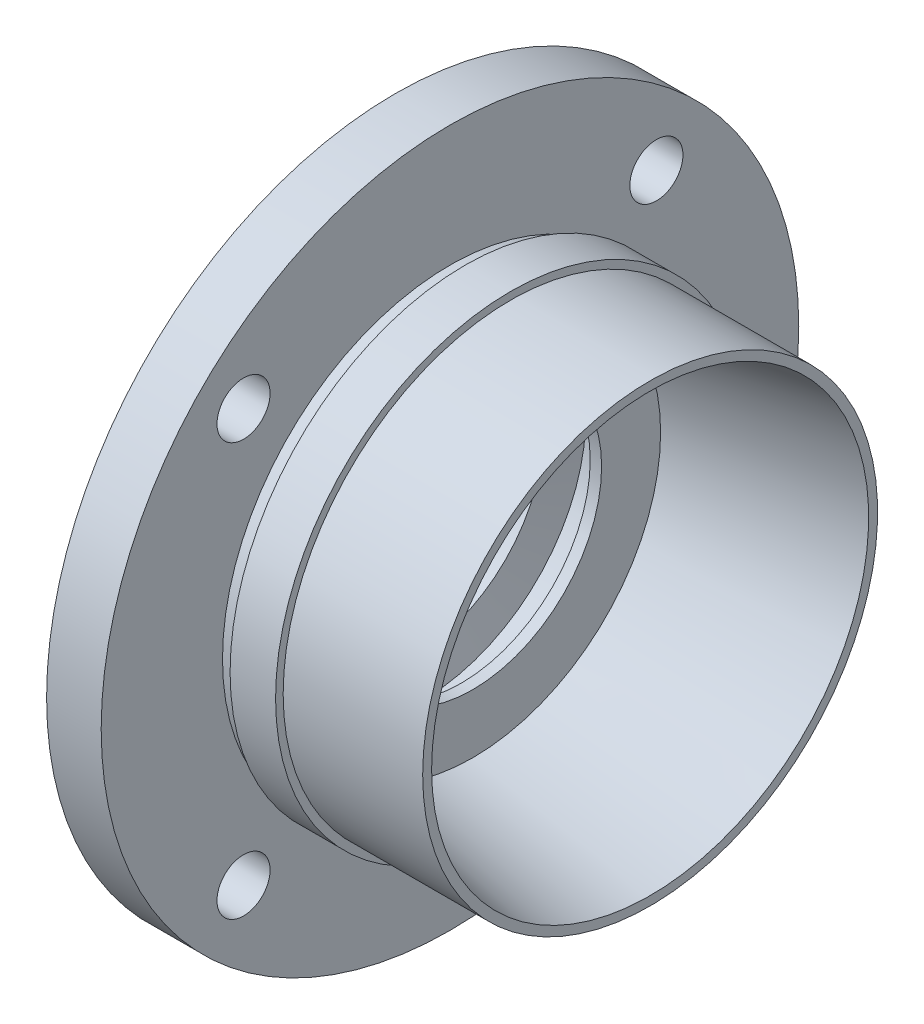
from build123d import *

# Parameters (mm, degrees)
SKETCH_2_R          = 3.5
CUT_EXTRUDE_1_DEPTH = 74.218576878


with BuildPart() as part:
    # 草图1 → 旋转1 (revolve)
    with BuildSketch(Plane.XY, mode=Mode.PRIVATE) as revolve_1_sk:
        Polygon((3.6, 21.5), (2.5, 17), (1, 17), (1, 30), (0, 30), (0, 46), (7.2, 46), (7.2, 30), (9.2, 30), (9.2, 31), (15.2, 31), (15.2, 30), (33.6, 30), (33.6, 28.8226), (10.2, 24.78), (10.2, 17), (8.7, 17), (7.6, 21.5), align=None)
    revolve(revolve_1_sk.sketch.rotate(Axis((0, 0, 0), (1, 0, 0)), 90), axis=Axis((0, 0, 0), (1, 0, 0)))

    # 草图2 → 切除-拉伸1 (cut, through all)
    with BuildSketch(Plane.ZY):
        with Locations((-27.223611076, 27.223611076)):
            Circle(SKETCH_2_R)
        with Locations((27.223611076, 27.223611076)):
            Circle(SKETCH_2_R)
        with Locations((-27.223611076, -27.223611076)):
            Circle(SKETCH_2_R)
        with Locations((27.223611076, -27.223611076)):
            Circle(SKETCH_2_R)
    extrude(amount=-CUT_EXTRUDE_1_DEPTH, mode=Mode.SUBTRACT)


solid = part.part
